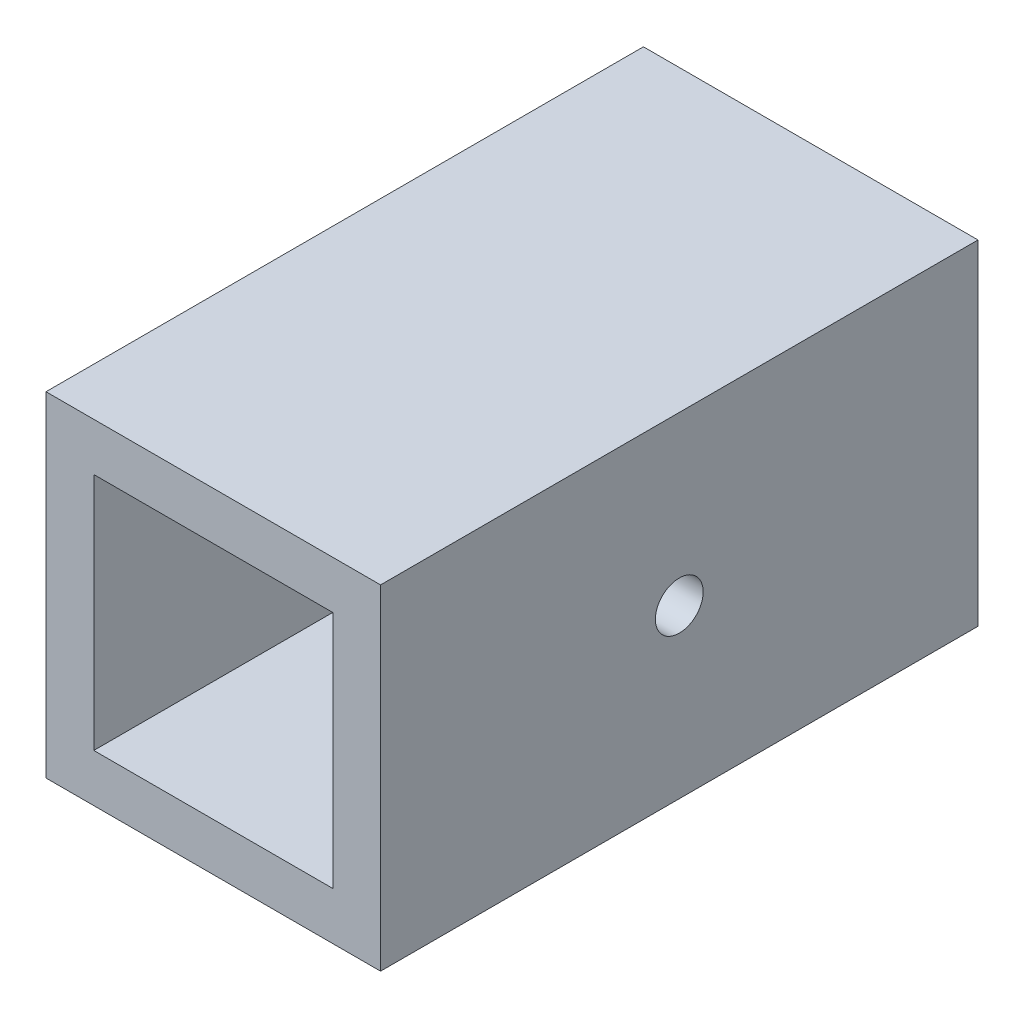
from build123d import *

# Parameters (mm, degrees)
SKETCH_1_W          = 14
SKETCH_1_H          = 14
SKETCH_1_W_2        = 10
SKETCH_1_H_2        = 10
EXTRUDE_1_DEPTH     = 10
SKETCH_2_W          = 14
SKETCH_2_H          = 14
EXTRUDE_2_DEPTH     = 5
SKETCH_3_W          = 14
SKETCH_3_H          = 14
SKETCH_3_W_2        = 10
SKETCH_3_H_2        = 10
EXTRUDE_3_DEPTH     = 10
SKETCH_6_R          = 1
CUT_EXTRUDE_1_DEPTH = 16


with BuildPart() as part:
    # 草图1 → 凸台-拉伸1 (new body)
    with BuildSketch(Plane.XY):
        with Locations((7, 7)):
            Rectangle(SKETCH_1_W, SKETCH_1_H)
        with Locations((7, 7)):
            Rectangle(SKETCH_1_W_2, SKETCH_1_H_2, mode=Mode.SUBTRACT)
    extrude(amount=EXTRUDE_1_DEPTH)

    # 草图2 → 凸台-拉伸2 (add)
    with BuildSketch(Plane.XY.offset(10)):
        with Locations((7, 7)):
            Rectangle(SKETCH_2_W, SKETCH_2_H)
    extrude(amount=EXTRUDE_2_DEPTH)

    # 草图3 → 凸台-拉伸3 (add)
    with BuildSketch(Plane.XY.offset(15)):
        with Locations((7, 7)):
            Rectangle(SKETCH_3_W, SKETCH_3_H)
        with Locations((7, 7)):
            Rectangle(SKETCH_3_W_2, SKETCH_3_H_2, mode=Mode.SUBTRACT)
    extrude(amount=EXTRUDE_3_DEPTH)

    # 草图6 → 切除-拉伸1 (cut)
    with BuildSketch(Plane(origin=(14, 0, 0), x_dir=(0, 0, -1), z_dir=(1, 0, 0))):
        with Locations((-12.5, 7)):
            Circle(SKETCH_6_R)
    extrude(amount=-CUT_EXTRUDE_1_DEPTH, mode=Mode.SUBTRACT)


solid = part.part
